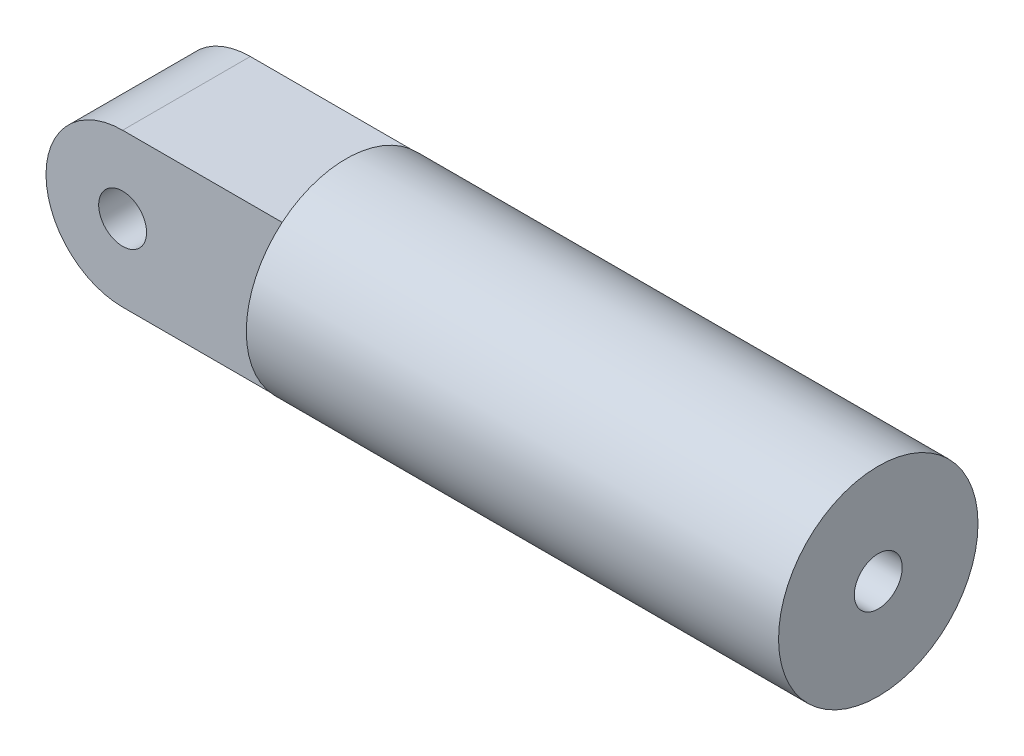
from build123d import *

# Parameters (mm, degrees)
SKETCH1_R           = 12.5
BOSS_EXTRUDE1_DEPTH = 66.71
SKETCH2_W           = 16.007
SKETCH2_H           = 19.203540064
BOSS_EXTRUDE2_DEPTH = 20
BOSS_EXTRUDE3_DEPTH = 16.007
SKETCH4_R           = 3
CUT_EXTRUDE1_DEPTH  = 71.900406291
SKETCH5_R           = 3
CUT_EXTRUDE2_DEPTH  = 15


with BuildPart() as part:
    # Sketch1 → Boss-Extrude1 (new body)
    with BuildSketch(Plane(origin=(0, 0, 0), x_dir=(0, 0, -1), z_dir=(1, 0, 0))):
        Circle(SKETCH1_R)
    extrude(amount=BOSS_EXTRUDE1_DEPTH)

    # Sketch2 → Boss-Extrude2 (add)
    with BuildSketch(Plane.ZY):
        Rectangle(SKETCH2_W, SKETCH2_H)
    extrude(amount=BOSS_EXTRUDE2_DEPTH)

    # Sketch3 → Boss-Extrude3 (add)
    with BuildSketch(Plane.XY.offset(8.0035)):
        with BuildLine():
            Line((-20, 9.601770032), (-20, -9.601770032))
            ThreePointArc((-20, -9.601770032), (-29.601770032, 0), (-20, 9.601770032))
        make_face()
    extrude(amount=-BOSS_EXTRUDE3_DEPTH)

    # Sketch4 → Cut-Extrude1 (cut, through all)
    with BuildSketch(Plane.XY.offset(8.0035)):
        with Locations((-20, 0)):
            Circle(SKETCH4_R)
    extrude(amount=-CUT_EXTRUDE1_DEPTH, mode=Mode.SUBTRACT)

    # Sketch5 → Cut-Extrude2 (cut)
    with BuildSketch(Plane(origin=(66.71, 0, 0), x_dir=(0, 0, -1), z_dir=(1, 0, 0))):
        Circle(SKETCH5_R)
    extrude(amount=-CUT_EXTRUDE2_DEPTH, mode=Mode.SUBTRACT)


solid = part.part
